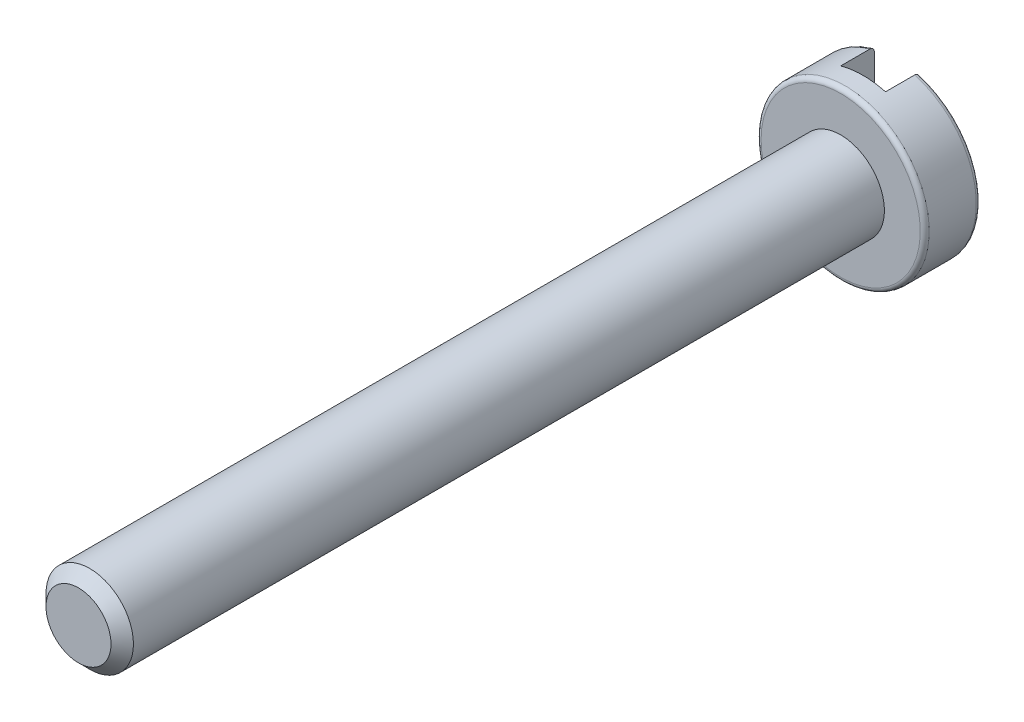
from build123d import *

# Parameters (mm, degrees)
SKETCH2_R           = 1.95
BOSS_EXTRUDE1_DEPTH = 34
SKETCH3_R           = 3.75
BOSS_EXTRUDE2_DEPTH = 2.5
SKETCH4_W           = 2
SKETCH4_H           = 10
CUT_EXTRUDE1_DEPTH  = 1.5
FILLET1_R           = 0.2
CHAMFER1_SIZE       = 0.5


with BuildPart() as part:
    # Sketch2 → Boss-Extrude1 (new body)
    with BuildSketch(Plane.XY):
        Circle(SKETCH2_R)
    extrude(amount=BOSS_EXTRUDE1_DEPTH)

    # Sketch3 → Boss-Extrude2 (add)
    with BuildSketch(Plane(origin=(0, 0, 0), x_dir=(-1, 0, 0), z_dir=(0, 0, -1))):
        Circle(SKETCH3_R)
    extrude(amount=BOSS_EXTRUDE2_DEPTH)

    # Sketch4 → Cut-Extrude1 (cut)
    with BuildSketch(Plane(origin=(0, 0, -2.5), x_dir=(-1, 0, 0), z_dir=(0, 0, -1))):
        Rectangle(SKETCH4_W, SKETCH4_H)
    extrude(amount=-CUT_EXTRUDE1_DEPTH, mode=Mode.SUBTRACT)

    # Fillet1
    fillet1_edges = [part.edges().sort_by_distance(p)[0] for p in [
        (-2.984334097, 2.270737766, -2.5),
        (3.75, 0, 0),
        (3.75, 0, -2.5),
    ]]
    fillet(fillet1_edges, radius=FILLET1_R)

    # Chamfer1
    chamfer1_edges = [part.edges().sort_by_distance(p)[0] for p in [
        (-1.95, 0, 34),
    ]]
    chamfer(chamfer1_edges, length=CHAMFER1_SIZE)


solid = part.part
